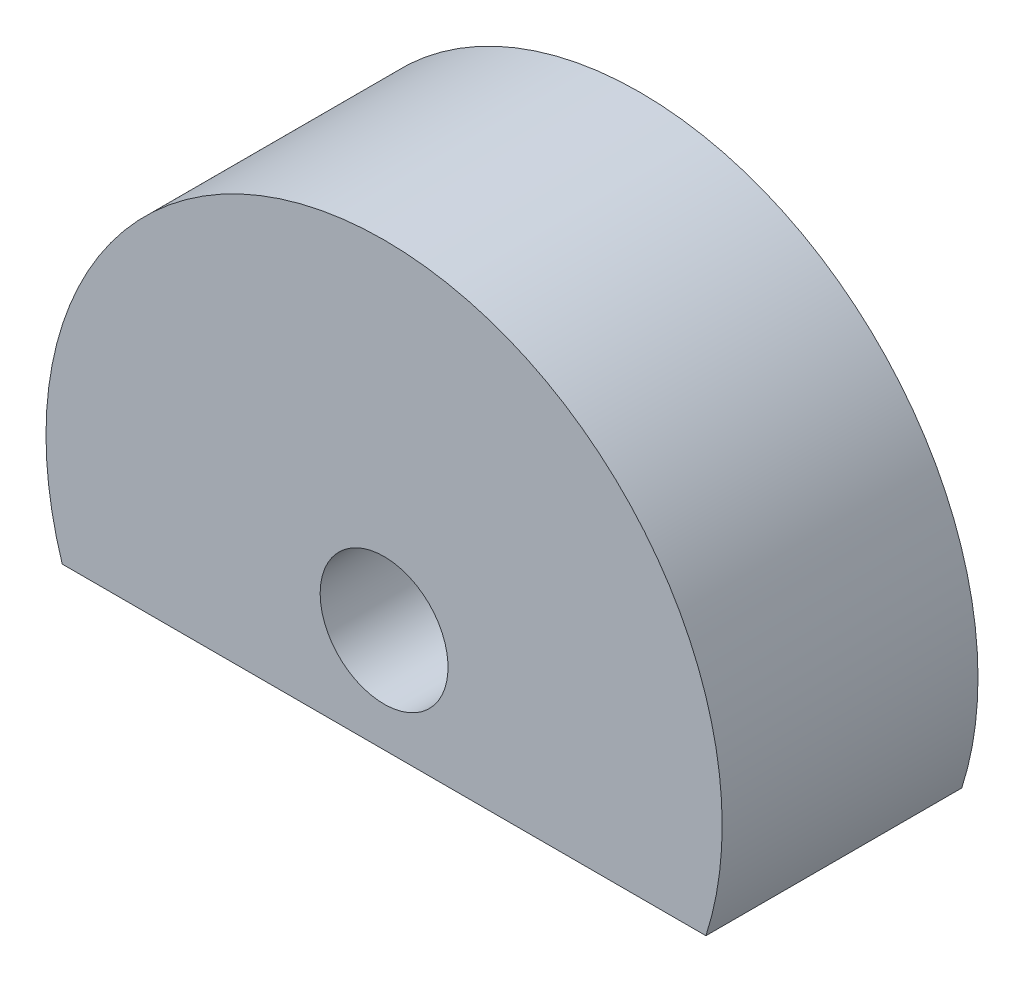
from build123d import *

# Parameters (mm, degrees)
BOSS_EXTRUDE1_DEPTH      = 6.35
BOSS_EXTRUDE1_DEPTH_BACK = 6.35
SKETCH1_R                = 2.667
SKETCH2_R                = 10.070680165
SKETCH2_R_2              = 1.905
BOSS_EXTRUDE2_DEPTH      = 16
SKETCH4_W                = 19.172603048
SKETCH4_H                = 6.985
CUT_EXTRUDE2_DEPTH       = 7.62
CUT_EXTRUDE3_DEPTH       = 87.58734866
CUT_EXTRUDE3_DEPTH_BACK  = 87.58734866
SKETCH6_W                = 20.14136033
SKETCH6_H                = 21.08


with BuildPart() as part:
    # Sketch1 → Boss-Extrude1 (new, two sides: drawn at the far end of the back side and taken through both)
    with BuildSketch(Plane.XY.offset(-BOSS_EXTRUDE1_DEPTH_BACK)):
        with Locations((-72.6, -136.95)):
            Circle(SKETCH1_R)
    extrude(amount=BOSS_EXTRUDE1_DEPTH + BOSS_EXTRUDE1_DEPTH_BACK)

    # Sketch2 → Boss-Extrude2 (add)
    with BuildSketch(Plane.XY.offset(6.35)):
        with Locations(Location((-72.6, -142.329319835, 0), (0, 0, 90))):
            Circle(SKETCH2_R)
        with Locations(Location((-72.6, -142.329319835, 0), (0, 0, 90))):
            Circle(SKETCH2_R_2, mode=Mode.SUBTRACT)
    extrude(amount=BOSS_EXTRUDE2_DEPTH)

    # Sketch4 → Cut-Extrude2 (cut)
    with BuildSketch(Plane(origin=(0, 0, 22.35), x_dir=(-1, 0, 0), z_dir=(0, 0, -1))):
        with Locations((72.6, -148.9075)):
            Rectangle(SKETCH4_W, SKETCH4_H)
    extrude(amount=CUT_EXTRUDE2_DEPTH, mode=Mode.SUBTRACT)

    # Sketch6 → Cut-Extrude3 (cut, two sides: drawn at the far end of the back side and taken through both)
    with BuildSketch(Plane.XZ.offset(139.617).offset(-CUT_EXTRUDE3_DEPTH_BACK)):
        with Locations((-72.6, 4.19)):
            Rectangle(SKETCH6_W, SKETCH6_H)
    extrude(amount=CUT_EXTRUDE3_DEPTH + CUT_EXTRUDE3_DEPTH_BACK, mode=Mode.SUBTRACT)


solid = part.part
